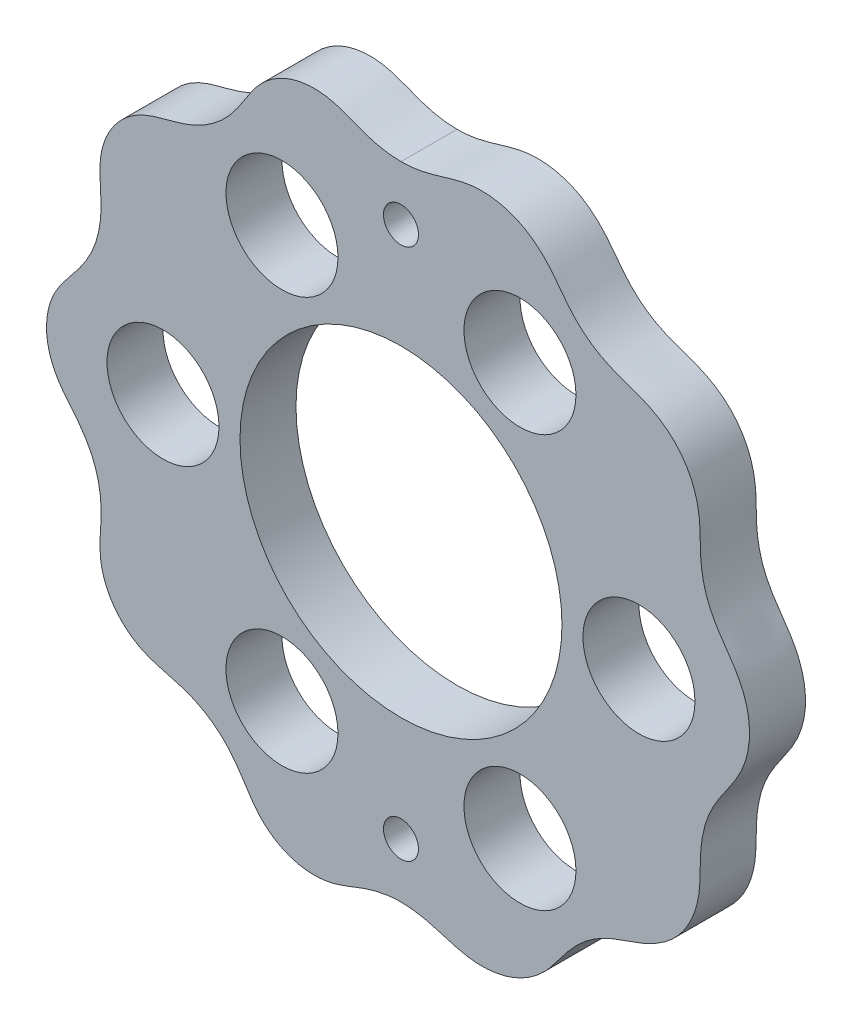
from build123d import *

# Parameters (mm, degrees)
BOSS_EXTRUDE1_DEPTH = 4
SKETCH2_R           = 4
SKETCH2_R_2         = 11.5
CUT_EXTRUDE1_DEPTH  = 36.347391688
SKETCH5_R           = 1.25
CUT_EXTRUDE3_DEPTH  = 36.347391688


with BuildPart() as part:
    # Sketch1 → Boss-Extrude1 (new body)
    with BuildSketch(Plane(origin=(0, 0, 0), x_dir=(0, 1, 0), z_dir=(0, 0, 1))):
        with BuildLine():
            add(Edge.make_bspline(
                [(22.9, -6.8e-08), (22.899999422, 0.849848246), (23.234494518, 2.557997031), (24.357147003, 4.842098973), (24.4090318, 7.388249433), (23.470730003, 9.298962577), (22.265526966, 10.447609913), (21.206740283, 11.12229966), (20.134689796, 11.81094856), (18.834304213, 12.929209311), (17.867994899, 14.373494068), (17.309160331, 15.990205569), (17.020287472, 17.224096279), (16.633315282, 18.412259986), (15.773214691, 19.840197418), (14.446728282, 20.902385971), (12.865760907, 21.430594119), (11.622085847, 21.538439649), (10.366866948, 21.439557863), (8.664148071, 21.378166553), (6.960814314, 21.719833588), (5.436962166, 22.511532381), (4.407655664, 23.272043326), (3.453820793, 24.101022612), (2.06703384, 25.022260676), (-5.1e-08, 25.520168125), (-2.067033934, 25.022260644), (-3.453820874, 24.101022561), (-4.407655746, 23.272043273), (-5.436962255, 22.511532337), (-6.960814413, 21.719833562), (-8.664148173, 21.378166548), (-10.366867049, 21.439557871), (-11.622085947, 21.538439652), (-12.865761005, 21.430594104), (-14.446728373, 20.902385931), (-15.773214765, 19.840197358), (-16.633315334, 18.412259914), (-17.02028751, 17.224096201), (-17.309160372, 15.99020549), (-17.867994956, 14.373493994), (-18.834304289, 12.929209249), (-20.134689883, 11.810948513), (-21.206740374, 11.122299619), (-22.26552705, 10.447609867), (-23.470730072, 9.298962511), (-24.409031829, 7.38824935), (-24.357147038, 4.842098903), (-23.234494348, 2.557996967), (-22.899999777, 0.849848258), (-22.9, -2.6e-08)],
                knots=[0.117046028, 0.117046028, 0.117046028, 0.117046028, 0.140980651, 0.164915274, 0.188849898, 0.212784521, 0.224751833, 0.236719144, 0.248686456, 0.260653768, 0.284588391, 0.296555702, 0.308523014, 0.320490326, 0.332457637, 0.356392261, 0.368359572, 0.380326884, 0.392294196, 0.404261507, 0.428196131, 0.440163442, 0.452130754, 0.464098065, 0.476065377, 0.5, 0.523934624, 0.535901935, 0.547869247, 0.559836559, 0.57180387, 0.595738494, 0.607705805, 0.619673117, 0.631640428, 0.64360774, 0.667542363, 0.679509675, 0.691476987, 0.703444298, 0.71541161, 0.739346233, 0.751313545, 0.763280856, 0.775248168, 0.78721548, 0.811150103, 0.835084726, 0.85901935, 0.882953973, 0.882953973, 0.882953973, 0.882953973], degree=3))
            add(Edge.make_bspline(
                [(-22.9, -2.6e-08), (-22.900000003, -0.047934359), (-22.90113085, -0.137145406), (-22.907860089, -0.368749393), (-22.93151593, -0.725843694), (-23.023864092, -1.451977083), (-23.379667136, -2.858816479), (-24.05927419, -4.795001299), (-23.971420071, -7.266526126), (-23.104429113, -9.133799466), (-22.026006285, -10.348707847), (-21.076662631, -11.116219922), (-20.077798917, -11.842454782), (-18.829839981, -12.945169366), (-17.646413307, -14.703773156), (-16.991283915, -17.104189401), (-15.832586005, -19.262377037), (-13.879759866, -20.798242058), (-11.50631709, -21.444643062), (-9.035407987, -21.311699136), (-6.96534162, -21.723960474), (-5.476738735, -22.483944232), (-4.454819454, -23.187615708), (-3.455026577, -23.896593992), (-2.017629533, -24.653158375), (1.8e-08, -25.064541368), (2.017629556, -24.653158317), (3.455026582, -23.896593899), (4.454819458, -23.187615608), (5.476738758, -22.483944155), (6.965341673, -21.723960451), (9.035408054, -21.311699207), (11.50631715, -21.444643141), (13.87975991, -20.798242058), (15.832586006, -19.262376985), (16.991283853, -17.104189312), (17.646413269, -14.703773083), (18.82984009, -12.945169306), (20.077798938, -11.842454834), (21.076662835, -11.116219888), (22.02600627, -10.348707936), (23.104429107, -9.133799375), (23.971421504, -7.266526351), (24.059268037, -4.794999873), (23.379695122, -2.858818549), (23.023861666, -1.451973273), (22.931516542, -0.725843931), (22.907859959, -0.36874924), (22.901130861, -0.137144866), (22.900000001, -0.047934226), (22.9, -6.8e-08)],
                knots=[0.077696516, 0.077696516, 0.077696516, 0.077696516, 0.079346139, 0.080995762, 0.084295008, 0.0908935, 0.104090484, 0.130484452, 0.156878419, 0.183272387, 0.196469371, 0.209666355, 0.222863339, 0.236060322, 0.26245429, 0.288848258, 0.315242226, 0.341636193, 0.368030161, 0.394424129, 0.420818096, 0.43401508, 0.447212064, 0.460409048, 0.473606032, 0.5, 0.526393967, 0.539590951, 0.552787935, 0.565984919, 0.579181903, 0.60557587, 0.631969838, 0.658363806, 0.684757773, 0.711151741, 0.737545709, 0.763939677, 0.77713666, 0.790333644, 0.803530628, 0.816727612, 0.84312158, 0.869515547, 0.895909515, 0.909106499, 0.915704991, 0.919004237, 0.92065386, 0.922303483, 0.922303483, 0.922303483, 0.922303483], degree=3))
        make_face()
    extrude(amount=BOSS_EXTRUDE1_DEPTH)

    # Sketch2 → Cut-Extrude1 (cut, through all)
    with BuildSketch(Plane.XY.offset(4)):
        with Locations((8.5, 14.722431864)):
            Circle(SKETCH2_R)
        Circle(SKETCH2_R_2)
        with Locations((-17, 0)):
            Circle(SKETCH2_R)
        with Locations((-8.5, -14.722431864)):
            Circle(SKETCH2_R)
        with Locations((8.5, -14.722431864)):
            Circle(SKETCH2_R)
        with Locations((17, 0)):
            Circle(SKETCH2_R)
        with Locations((-8.5, 14.722431864)):
            Circle(SKETCH2_R)
    extrude(amount=-CUT_EXTRUDE1_DEPTH, mode=Mode.SUBTRACT)

    # Sketch5 → Cut-Extrude3 (cut, through all)
    with BuildSketch(Plane.XY.offset(4)):
        with Locations((0, -19)):
            Circle(SKETCH5_R)
        with Locations((0, 19)):
            Circle(SKETCH5_R)
    extrude(amount=-CUT_EXTRUDE3_DEPTH, mode=Mode.SUBTRACT)


solid = part.part
